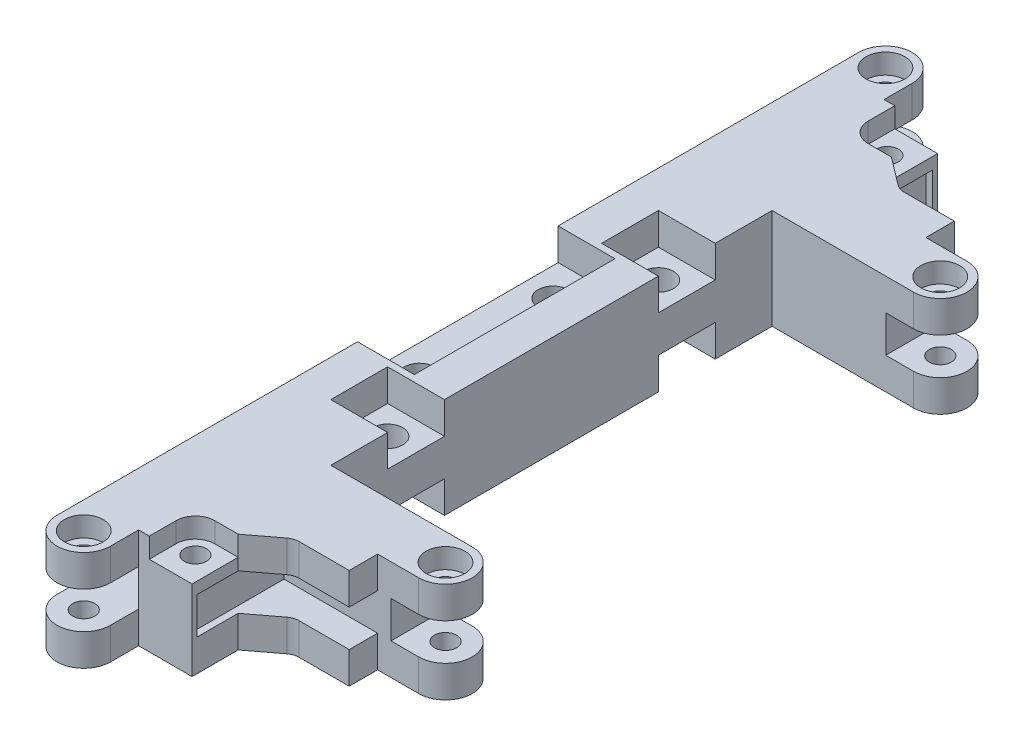
from build123d import *

# Parameters (mm, degrees)
BOSS_EXTRUDE1_DEPTH      = 7.5
BOSS_EXTRUDE1_DEPTH_BACK = 7.5
SKETCH1_R                = 2.25
SKETCH1_R_2              = 1.65
SKETCH2_W                = 8.2
SKETCH2_H                = 5.5
CUT_EXTRUDE1_DEPTH       = 71.61765006
SKETCH2_5_W              = 14
SKETCH2_5_H              = 5.5
CUT_EXTRUDE7_DEPTH       = 14
CUT_EXTRUDE8_START       = -29
SKETCH5_W                = 38.5
SKETCH5_H                = 5.5
CUT_EXTRUDE8_DEPTH       = 8
CUT_EXTRUDE4_START       = 2
SKETCH4_W                = 8
SKETCH4_H                = 5.5
CUT_EXTRUDE4_DEPTH       = 69.61765006
CUT_EXTRUDE5_START       = -2.75
SKETCH1_3_W              = 8.5
SKETCH1_3_H              = 15
SKETCH1_3_R              = 2.25
SKETCH1_3_H_2            = 8.5
CUT_EXTRUDE5_DEPTH       = 68.86765006
CUT_EXTRUDE6_DEPTH       = 71.61765006
CUT_EXTRUDE6_DEPTH_BACK  = 71.61765006
SKETCH1_4_R              = 2.25
CUT_EXTRUDE9_START       = 4.5
SKETCH1_5_R              = 2.9
SKETCH1_5_R_2            = 1.65
CUT_EXTRUDE9_DEPTH       = 3
CUT_EXTRUDE10_START      = -7.5
CUT_EXTRUDE10_DEPTH      = 2.2


with BuildPart() as part:
    # Sketch1 → Boss-Extrude1 (new, two sides: drawn at the far end of the back side and taken through both)
    with BuildSketch(Plane(origin=(0, 0, 0), x_dir=(1, 0, 0), z_dir=(0, 1, 0)).offset(-BOSS_EXTRUDE1_DEPTH_BACK)):
        with BuildLine():
            Line((-15, 33), (6.15, 33))
            ThreePointArc((6.15, 33), (10.15, 37), (6.15, 41))
            Line((6.15, 41), (0, 41))
            Line((0, 41), (0, 45.25))
            Line((0, 45.25), (-7.5, 45.25))
            ThreePointArc((-7.5, 45.25), (-8.217662602, 45.367522476), (-8.860354994, 45.707812987))
            Line((-8.860354994, 45.707812987), (-13, 48.85))
            Line((-13, 48.85), (-13, 55.75))
            Line((-13, 55.75), (-21, 55.75))
            Line((-21, 55.75), (-21, 59.95))
            ThreePointArc((-21, 59.95), (-25, 63.95), (-29, 59.95))
            Line((-29, 59.95), (-29, 0))
            Line((-29, 0), (-15, 0))
            Line((-15, 0), (-15, 33))
        make_face()
        with Locations(Location((-19.25, 20.25, 0), (0, 0, 270))):
            Circle(SKETCH1_R, mode=Mode.SUBTRACT)
        with Locations(Location((-16.5, 51.75, 0), (0, 0, 270))):
            Circle(SKETCH1_R_2, mode=Mode.SUBTRACT)
        with Locations(Location((-25, 59.95, 0), (0, 0, 270))):
            Circle(SKETCH1_R_2, mode=Mode.SUBTRACT)
        with Locations(Location((6.15, 37, 0), (0, 0, 270))):
            Circle(SKETCH1_R_2, mode=Mode.SUBTRACT)
    extrude(amount=BOSS_EXTRUDE1_DEPTH + BOSS_EXTRUDE1_DEPTH_BACK)

    # Sketch2 → Cut-Extrude1 (cut, through all)
    with BuildSketch(Plane(origin=(0, 0, 0), x_dir=(0, 0, -1), z_dir=(1, 0, 0))):
        with Locations((59.85, 0)):
            Rectangle(SKETCH2_W, SKETCH2_H)
    extrude(amount=-CUT_EXTRUDE1_DEPTH, mode=Mode.SUBTRACT)

    # Sketch2<5> → Cut-Extrude7 (cut)
    with BuildSketch(Plane(origin=(0, 0, 0), x_dir=(0, 0, -1), z_dir=(1, 0, 0))):
        with Locations((48, 0)):
            Rectangle(SKETCH2_5_W, SKETCH2_5_H)
    extrude(amount=-CUT_EXTRUDE7_DEPTH, mode=Mode.SUBTRACT)

    # Sketch5 → Cut-Extrude8 (cut)
    with BuildSketch(Plane(origin=(0, 0, 0), x_dir=(0, 0, -1), z_dir=(1, 0, 0)).offset(CUT_EXTRUDE8_START)):
        with Locations((44.7, 0)):
            Rectangle(SKETCH5_W, SKETCH5_H)
    extrude(amount=CUT_EXTRUDE8_DEPTH, mode=Mode.SUBTRACT)

    # Sketch4 → Cut-Extrude4 (cut, through all)
    with BuildSketch(Plane(origin=(0, 0, 0), x_dir=(0, 0, -1), z_dir=(1, 0, 0)).offset(CUT_EXTRUDE4_START)):
        with Locations((37, 0)):
            Rectangle(SKETCH4_W, SKETCH4_H)
    extrude(amount=CUT_EXTRUDE4_DEPTH, mode=Mode.SUBTRACT)

    # Sketch1<3> → Cut-Extrude5 (cut, through all)
    # profile 1 of 3: a face of its own
    with BuildSketch(Plane(origin=(0, 0, 0), x_dir=(1, 0, 0), z_dir=(0, 1, 0)).offset(CUT_EXTRUDE5_START)):
        with Locations((-24.75, 7.5)):
            Rectangle(SKETCH1_3_W, SKETCH1_3_H)
        with Locations((-24.75, 10)):
            Circle(SKETCH1_3_R, mode=Mode.SUBTRACT)
    # profile 2 of 3: a face of its own
    with BuildSketch(Plane(origin=(0, 0, 0), x_dir=(1, 0, 0), z_dir=(0, 1, 0)).offset(CUT_EXTRUDE5_START)):
        with Locations((-24.75, 10)):
            Circle(SKETCH1_3_R)
    # profile 3 of 3: a face of its own
    with BuildSketch(Plane(origin=(0, 0, 0), x_dir=(1, 0, 0), z_dir=(0, 1, 0)).offset(CUT_EXTRUDE5_START)):
        with Locations((-19.25, 20.25)):
            Rectangle(SKETCH1_3_W, SKETCH1_3_H_2)
        with Locations(Location((-19.25, 20.25, 0), (0, 0, 270))):
            Circle(SKETCH1_3_R, mode=Mode.SUBTRACT)
    cut_extrude5 = extrude(amount=-CUT_EXTRUDE5_DEPTH, mode=Mode.SUBTRACT)

    # Mirror2: Cut-Extrude5 across plane
    add(cut_extrude5.mirror(Plane.ZX), mode=Mode.SUBTRACT)

    # Sketch1<4> → Cut-Extrude6 (cut, two sides: drawn at the far end of the back side and taken through both)
    with BuildSketch(Plane(origin=(0, 0, 0), x_dir=(1, 0, 0), z_dir=(0, 1, 0)).offset(-CUT_EXTRUDE6_DEPTH_BACK)):
        with Locations(Location((-24.75, 10, 0), (0, 0, 270))):
            Circle(SKETCH1_4_R)
    extrude(amount=CUT_EXTRUDE6_DEPTH + CUT_EXTRUDE6_DEPTH_BACK, mode=Mode.SUBTRACT)

    # Sketch1<5> → Cut-Extrude9 (cut)
    # profile 1 of 4: a face of its own
    with BuildSketch(Plane(origin=(0, 0, 0), x_dir=(1, 0, 0), z_dir=(0, 1, 0)).offset(CUT_EXTRUDE9_START)):
        with Locations(Location((-25, 59.95, 0), (0, 0, 270))):
            Circle(SKETCH1_5_R)
        with Locations(Location((-25, 59.95, 0), (0, 0, 270))):
            Circle(SKETCH1_5_R_2, mode=Mode.SUBTRACT)
    # profile 2 of 4: a face of its own
    with BuildSketch(Plane(origin=(0, 0, 0), x_dir=(1, 0, 0), z_dir=(0, 1, 0)).offset(CUT_EXTRUDE9_START)):
        with Locations((-16.5, 51.75)):
            Circle(SKETCH1_5_R)
        with Locations(Location((-16.5, 51.75, 0), (0, 0, 270))):
            Circle(SKETCH1_5_R_2, mode=Mode.SUBTRACT)
    # profile 3 of 4: a face of its own
    with BuildSketch(Plane(origin=(0, 0, 0), x_dir=(1, 0, 0), z_dir=(0, 1, 0)).offset(CUT_EXTRUDE9_START)):
        with Locations(Location((6.15, 37, 0), (0, 0, 270))):
            Circle(SKETCH1_5_R)
        with Locations(Location((6.15, 37, 0), (0, 0, 270))):
            Circle(SKETCH1_5_R_2, mode=Mode.SUBTRACT)
    # profile 4 of 4: a face of its own
    with BuildSketch(Plane(origin=(0, 0, 0), x_dir=(1, 0, 0), z_dir=(0, 1, 0)).offset(CUT_EXTRUDE9_START)):
        with BuildLine():
            Line((-16.5, 48.85), (-13, 48.85))
            Line((-13, 48.85), (-13, 52.75))
            Line((-13, 52.75), (-13, 55.75))
            Line((-13, 55.75), (-19.4, 55.75))
            Line((-19.4, 55.75), (-19.4, 51.75))
            ThreePointArc((-19.4, 51.75), (-16.5, 54.65), (-13.6, 51.75))
            ThreePointArc((-13.6, 51.75), (-14.449390335, 49.699390335), (-16.5, 48.85))
        make_face()
    extrude(amount=CUT_EXTRUDE9_DEPTH, mode=Mode.SUBTRACT)

    # Sketch6 → Cut-Extrude10 (cut)
    with BuildSketch(Plane(origin=(0, 0, 0), x_dir=(1, 0, 0), z_dir=(0, 1, 0)).offset(CUT_EXTRUDE10_START)):
        Polygon((-21.651368439, 59.95), (-23.325684219, 62.85), (-26.674315781, 62.85), (-28.348631561, 59.95), (-26.674315781, 57.05), (-23.325684219, 57.05), align=None)
        Polygon((-13.151368439, 51.75), (-14.825684219, 54.65), (-18.174315781, 54.65), (-19.848631561, 51.75), (-18.174315781, 48.85), (-14.825684219, 48.85), align=None)
        Polygon((9.498631561, 37), (7.824315781, 39.9), (4.475684219, 39.9), (2.801368439, 37), (4.475684219, 34.1), (7.824315781, 34.1), align=None)
    extrude(amount=CUT_EXTRUDE10_DEPTH, mode=Mode.SUBTRACT)

    # Mirror3: part across plane


with BuildPart() as part_1:
    add(part.part)
    add(part.part.mirror(Plane.XY))


solid = part_1.part
